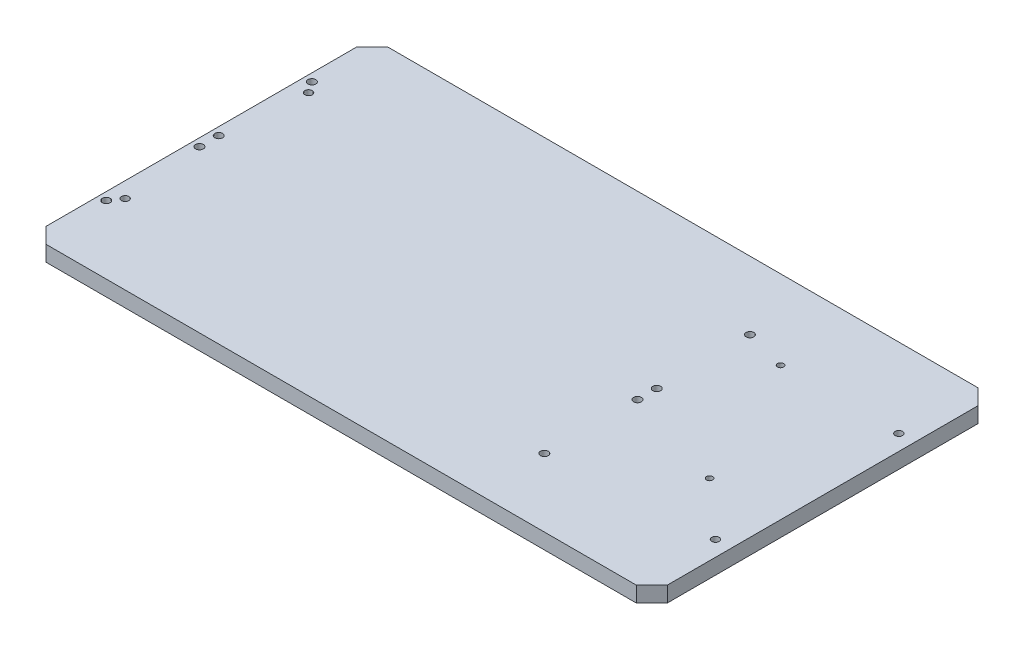
from build123d import *

# Parameters (mm, degrees)
SKETCH1_W           = 254
SKETCH1_H           = 139.7
SKETCH1_R           = 1.5
SKETCH1_R_2         = 1.5875
BOSS_EXTRUDE1_DEPTH = 6.35
SKETCH2_R           = 1.25
CUT_EXTRUDE1_DEPTH  = 6.35
CHAMFER1_SIZE       = 6.35


with BuildPart() as part:
    # Sketch1 → Boss-Extrude1 (new body)
    with BuildSketch(Plane(origin=(0, 0, 0), x_dir=(1, 0, 0), z_dir=(0, 1, 0))):
        with Locations((127, 69.85)):
            Rectangle(SKETCH1_W, SKETCH1_H)
        with Locations(Location((6.35, 107.3404, 0), (0, 0, 270))):
            Circle(SKETCH1_R, mode=Mode.SUBTRACT)
        with Locations(Location((6.35, 32.3596, 0), (0, 0, 270))):
            Circle(SKETCH1_R, mode=Mode.SUBTRACT)
        with Locations(Location((247.65, 107.3404, 0), (0, 0, 90))):
            Circle(SKETCH1_R, mode=Mode.SUBTRACT)
        with Locations(Location((247.65, 32.3596, 0), (0, 0, 90))):
            Circle(SKETCH1_R, mode=Mode.SUBTRACT)
        with Locations(Location((3.175, 73.787, 0), (0, 0, 270))):
            Circle(SKETCH1_R_2, mode=Mode.SUBTRACT)
        with Locations(Location((3.175, 65.913, 0), (0, 0, 270))):
            Circle(SKETCH1_R_2, mode=Mode.SUBTRACT)
        with Locations(Location((3.175, 27.813, 0), (0, 0, 270))):
            Circle(SKETCH1_R_2, mode=Mode.SUBTRACT)
        with Locations(Location((3.175, 111.887, 0), (0, 0, 270))):
            Circle(SKETCH1_R_2, mode=Mode.SUBTRACT)
        with Locations(Location((182.245, 27.813, 0), (0, 0, 90))):
            Circle(SKETCH1_R_2, mode=Mode.SUBTRACT)
        with Locations(Location((182.245, 65.913, 0), (0, 0, 90))):
            Circle(SKETCH1_R_2, mode=Mode.SUBTRACT)
        with Locations(Location((182.245, 73.787, 0), (0, 0, 90))):
            Circle(SKETCH1_R_2, mode=Mode.SUBTRACT)
        with Locations(Location((182.245, 111.887, 0), (0, 0, 90))):
            Circle(SKETCH1_R_2, mode=Mode.SUBTRACT)
    extrude(amount=BOSS_EXTRUDE1_DEPTH)

    # Sketch2 → Cut-Extrude1 (cut)
    with BuildSketch(Plane(origin=(0, 6.35, 0), x_dir=(1, 0, 0), z_dir=(0, 1, 0))):
        with Locations(Location((199.324, 107.305, 0), (0, 0, 270))):
            Circle(SKETCH2_R)
        with Locations(Location((224.824, 52.805, 0), (0, 0, 270))):
            Circle(SKETCH2_R)
    extrude(amount=-CUT_EXTRUDE1_DEPTH, mode=Mode.SUBTRACT)

    # Chamfer1
    chamfer1_edges = [part.edges().sort_by_distance(p)[0] for p in [
        (254, 3.175, 0),
        (0, 3.175, 0),
        (0, 3.175, -139.7),
        (254, 3.175, -139.7),
    ]]
    chamfer(chamfer1_edges, length=CHAMFER1_SIZE)


solid = part.part
